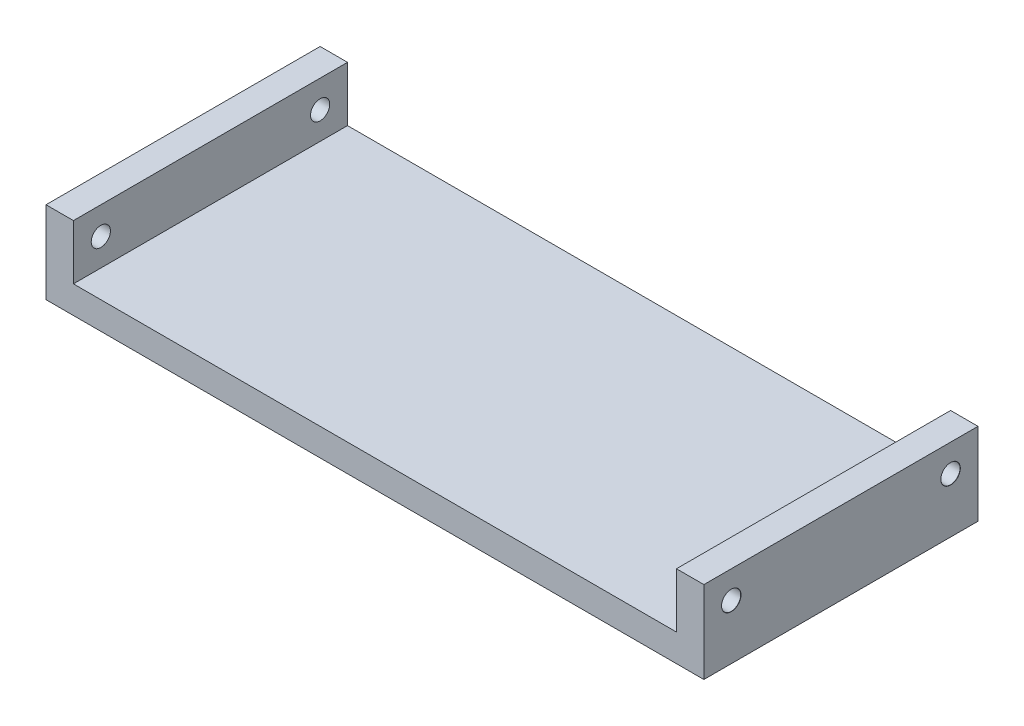
from build123d import *

# Parameters (mm, degrees)
SKETCH1_W                            = 120
SKETCH1_H                            = 50
BOSS_EXTRUDE1_DEPTH                  = 5
SKETCH2_W                            = 5
SKETCH2_H                            = 50
BOSS_EXTRUDE2_DEPTH                  = 10
F_3_5_3_5_DIAMETER_HOLE1_D           = 3.5
F_3_5_3_5_DIAMETER_HOLE1_CSINK_D     = 3.55
F_3_5_3_5_DIAMETER_HOLE1_CSINK_ANGLE = 90


with BuildPart() as part:
    # Sketch1 → Boss-Extrude1 (new body)
    with BuildSketch(Plane(origin=(0, 0, 0), x_dir=(1, 0, 0), z_dir=(0, 1, 0))):
        Rectangle(SKETCH1_W, SKETCH1_H)
    extrude(amount=BOSS_EXTRUDE1_DEPTH)

    # Sketch2 → Boss-Extrude2 (add)
    with BuildSketch(Plane(origin=(0, 5, 0), x_dir=(1, 0, 0), z_dir=(0, 1, 0))):
        with Locations((-57.5, 0)):
            Rectangle(SKETCH2_W, SKETCH2_H)
        with Locations((57.5, 0)):
            Rectangle(SKETCH2_W, SKETCH2_H)
    extrude(amount=BOSS_EXTRUDE2_DEPTH)

    # Ø3.5 (3.5) Diameter Hole1 (through all)
    with Locations(Plane(origin=(60, 0, 0), x_dir=(0, 0, -1), z_dir=(1, 0, 0))):
        with Locations((-20, 10), (20, 10)):
            CounterSinkHole(F_3_5_3_5_DIAMETER_HOLE1_D / 2, F_3_5_3_5_DIAMETER_HOLE1_CSINK_D / 2, counter_sink_angle=F_3_5_3_5_DIAMETER_HOLE1_CSINK_ANGLE)


solid = part.part
